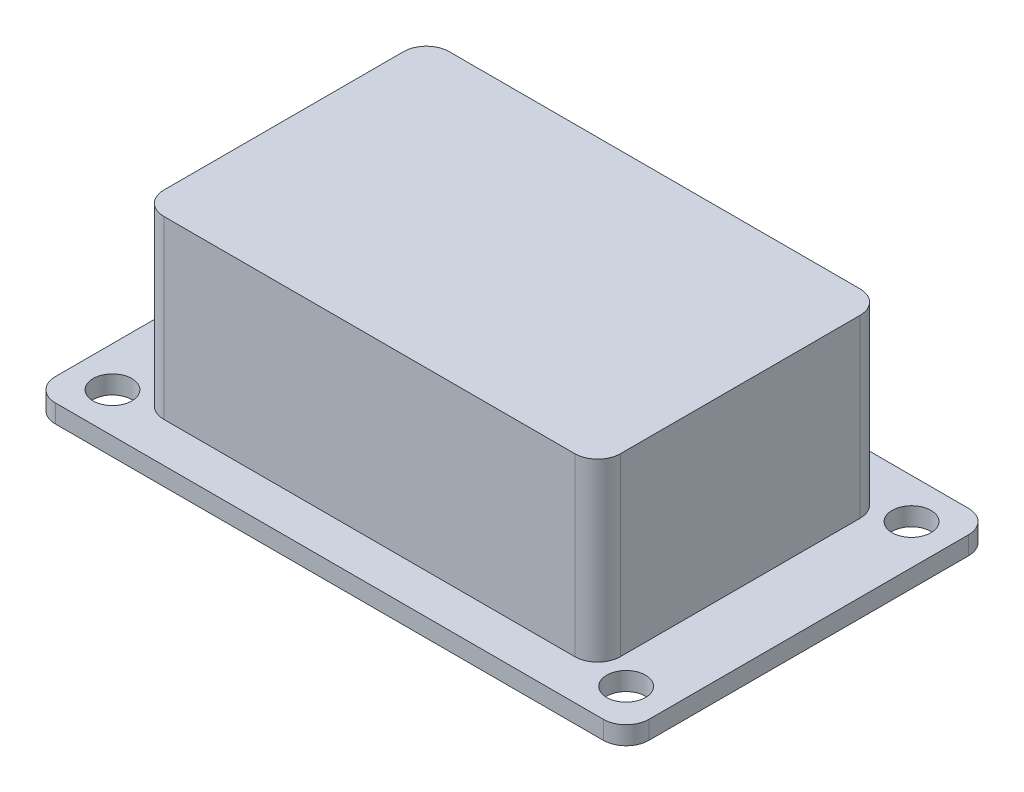
from build123d import *

# Parameters (mm, degrees)
BOSS_EXTRUDE1_DEPTH = 1.6
BOSS_EXTRUDE2_DEPTH = 15.4
SKETCH3_R           = 1.7
CUT_EXTRUDE1_DEPTH  = 1.6


with BuildPart() as part:
    # Sketch1 → Boss-Extrude1 (new body)
    with BuildSketch(Plane(origin=(0, 0, 0), x_dir=(1, 0, 0), z_dir=(0, 1, 0))):
        with BuildLine():
            Line((-24, -16), (24, -16))
            ThreePointArc((24, -16), (25.414213562, -15.414213562), (26, -14))
            Line((26, -14), (26, 14))
            ThreePointArc((26, 14), (25.414213562, 15.414213562), (24, 16))
            Line((24, 16), (-24, 16))
            ThreePointArc((-24, 16), (-25.414213562, 15.414213562), (-26, 14))
            Line((-26, 14), (-26, -14))
            ThreePointArc((-26, -14), (-25.414213562, -15.414213562), (-24, -16))
        make_face()
    extrude(amount=BOSS_EXTRUDE1_DEPTH)

    # Sketch2 → Boss-Extrude2 (add)
    with BuildSketch(Plane(origin=(0, 1.6, 0), x_dir=(1, 0, 0), z_dir=(0, 1, 0))):
        with BuildLine():
            Line((-18, -12.5), (18, -12.5))
            ThreePointArc((18, -12.5), (19.414213562, -11.914213562), (20, -10.5))
            Line((20, -10.5), (20, 10.5))
            ThreePointArc((20, 10.5), (19.414213562, 11.914213562), (18, 12.5))
            Line((18, 12.5), (-18, 12.5))
            ThreePointArc((-18, 12.5), (-19.414213562, 11.914213562), (-20, 10.5))
            Line((-20, 10.5), (-20, -10.5))
            ThreePointArc((-20, -10.5), (-19.414213562, -11.914213562), (-18, -12.5))
        make_face()
    extrude(amount=BOSS_EXTRUDE2_DEPTH)

    # Sketch3 → Cut-Extrude1 (cut)
    with BuildSketch(Plane(origin=(0, 0, 0), x_dir=(1, 0, 0), z_dir=(0, 1, 0))):
        with Locations(Location((22.5, -12.5, 0), (0, 0, 270))):
            Circle(SKETCH3_R)
        with Locations(Location((22.5, 12.5, 0), (0, 0, 270))):
            Circle(SKETCH3_R)
        with Locations(Location((-22.5, -12.5, 0), (0, 0, 270))):
            Circle(SKETCH3_R)
        with Locations(Location((-22.5, 12.5, 0), (0, 0, 270))):
            Circle(SKETCH3_R)
    extrude(amount=CUT_EXTRUDE1_DEPTH, mode=Mode.SUBTRACT)


solid = part.part
